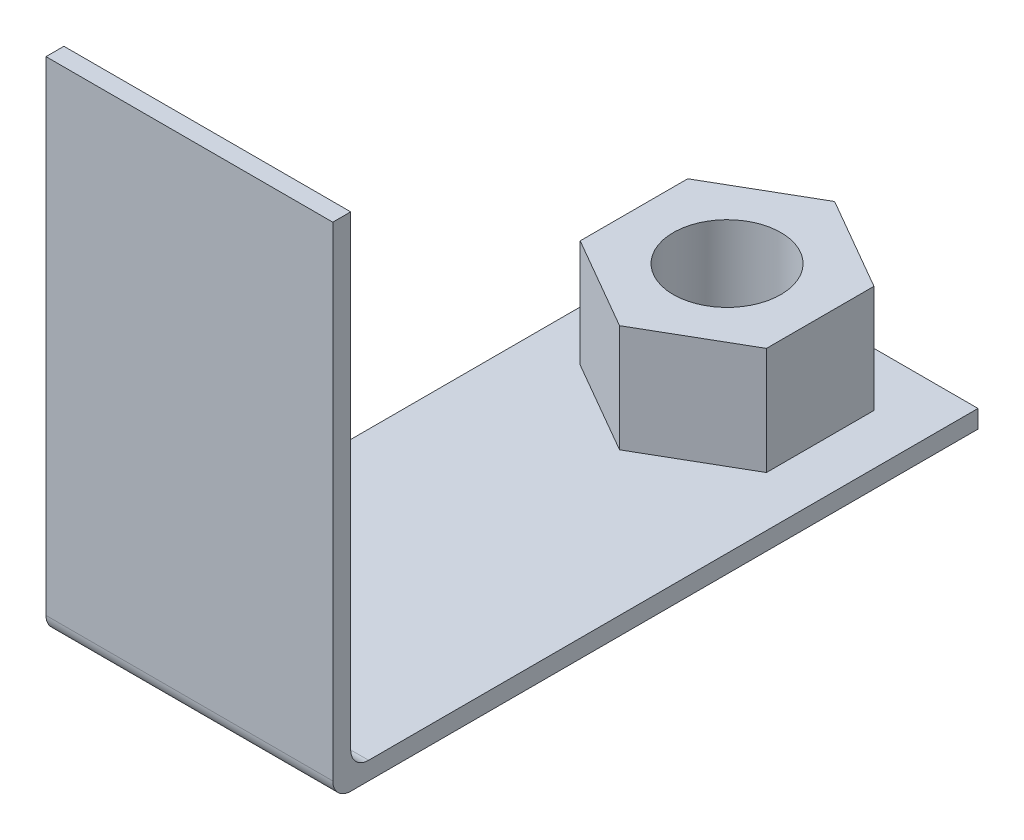
from build123d import *

# Parameters (mm, degrees)
BOSS_EXTRUDE1_DEPTH = 0.5
SKETCH2_W           = 8
SKETCH2_H           = 0.5
BOSS_EXTRUDE2_DEPTH = 14
BOSS_EXTRUDE3_DEPTH = 3
SKETCH4_R           = 1.5
CUT_EXTRUDE1_DEPTH  = 13
FILLET1_R           = 0.5
FILLET2_R           = 0.5
SKETCH5_R           = 2.838371804
BOSS_EXTRUDE4_DEPTH = 0.3


with BuildPart() as part:
    # Sketch1 → Boss-Extrude1 (new body)
    with BuildSketch(Plane(origin=(0, 0, 0), x_dir=(1, 0, 0), z_dir=(0, 1, 0))):
        Polygon((0, 0), (-4, 0), (-4, 18), (4, 18), (4, 0), align=None)
    extrude(amount=BOSS_EXTRUDE1_DEPTH)

    # Sketch2 → Boss-Extrude2 (add)
    with BuildSketch(Plane(origin=(0, 0, 0), x_dir=(1, 0, 0), z_dir=(0, 1, 0))):
        with Locations((0, 0.25)):
            Rectangle(SKETCH2_W, SKETCH2_H)
    extrude(amount=BOSS_EXTRUDE2_DEPTH)

    # Sketch3 → Boss-Extrude3 (add)
    with BuildSketch(Plane(origin=(0, 0.5, 0), x_dir=(1, 0, 0), z_dir=(0, 1, 0))):
        Polygon((0, 18), (-2.598076211, 16.5), (-2.598076211, 13.5), (0, 12), (2.598076211, 13.5), (2.598076211, 16.5), align=None)
    extrude(amount=BOSS_EXTRUDE3_DEPTH)

    # Sketch4 → Cut-Extrude1 (cut)
    with BuildSketch(Plane(origin=(0, 3.5, 0), x_dir=(1, 0, 0), z_dir=(0, 1, 0))):
        with Locations(Location((0, 15, 0), (0, 0, 270))):
            Circle(SKETCH4_R)
    extrude(amount=-CUT_EXTRUDE1_DEPTH, mode=Mode.SUBTRACT)

    # Fillet1
    fillet1_edges = [part.edges().sort_by_distance(p)[0] for p in [
        (0, 0, 0),
    ]]
    fillet(fillet1_edges, radius=FILLET1_R)

    # Fillet2
    fillet2_edges = [part.edges().sort_by_distance(p)[0] for p in [
        (0, 0.5, -0.5),
    ]]
    fillet(fillet2_edges, radius=FILLET2_R)

    # Sketch5 → Boss-Extrude4 (add)
    with BuildSketch(Plane(origin=(0, 0, -0.5), x_dir=(-1, 0, 0), z_dir=(0, 0, -1))):
        with Locations(Location((0, 10.341282462, 0), (0, 0, 180))):
            Circle(SKETCH5_R)
    extrude(amount=BOSS_EXTRUDE4_DEPTH)


solid = part.part
